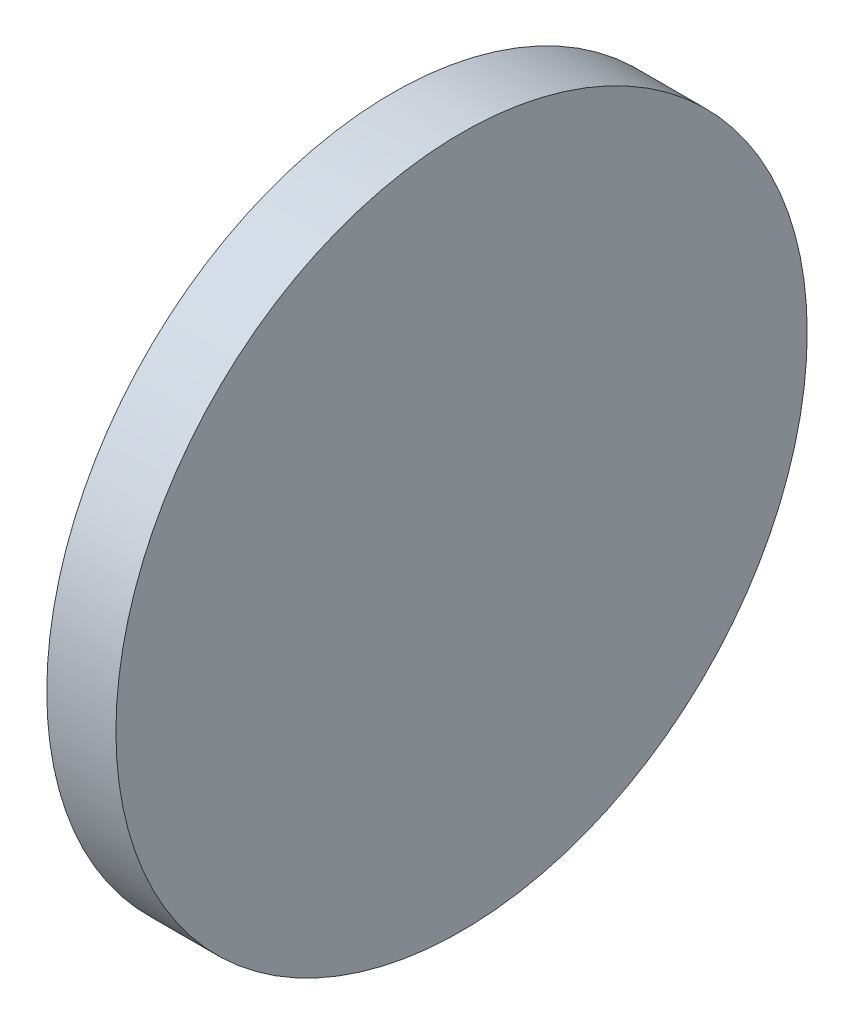
from build123d import *

# Parameters (mm, degrees)
SKETCH1_R           = 50
BOSS_EXTRUDE1_DEPTH = 10


with BuildPart() as part:
    # Sketch1 → Boss-Extrude1 (new body)
    with BuildSketch(Plane(origin=(0, 0, 0), x_dir=(0, 0, -1), z_dir=(1, 0, 0))):
        Circle(SKETCH1_R)
    extrude(amount=BOSS_EXTRUDE1_DEPTH)


solid = part.part
